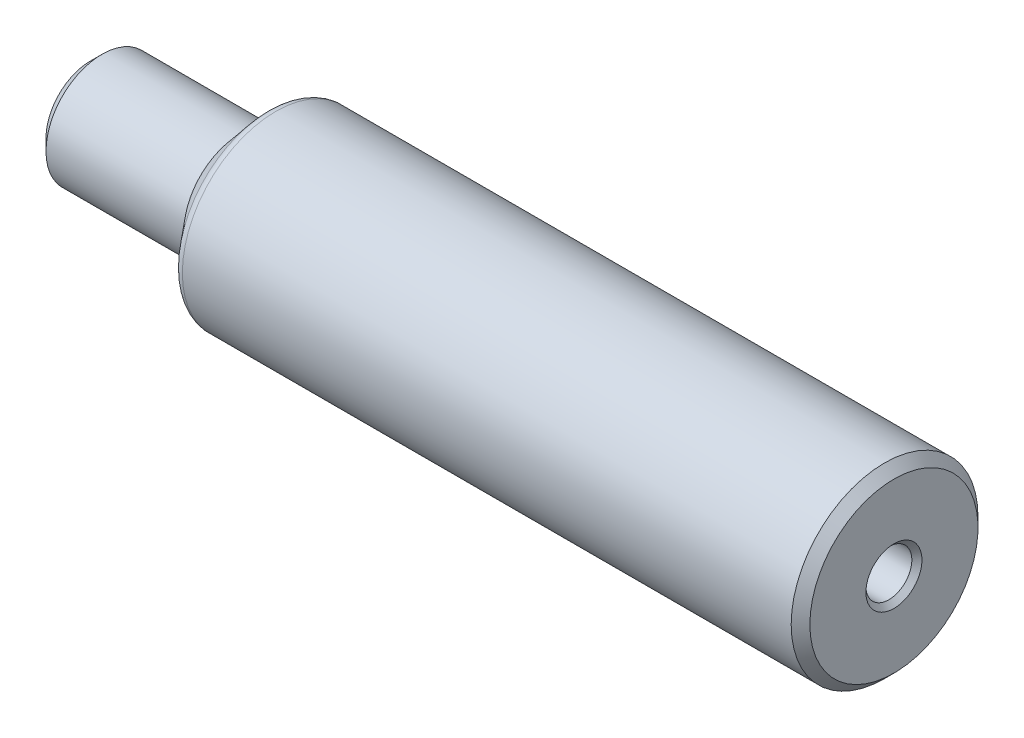
from build123d import *

# Parameters (mm, degrees)
FILLET1_R = 0.5


with BuildPart() as part:
    # Sketch1 → Revolve1 (revolve)
    with BuildSketch(Plane.XY, mode=Mode.PRIVATE) as revolve1_sk:
        Polygon((0, 0), (0, 4.5), (0.5, 5), (34.5, 5), (35, 4.5), (35, 0), align=None)
    revolve(revolve1_sk.sketch.rotate(Axis((35, 0, 0), (-1, 0, 0)), 270), axis=Axis((35, 0, 0), (-1, 0, 0)))

    # Sketch2 → Revolve2 (revolve)
    with BuildSketch(Plane.XY, mode=Mode.PRIVATE) as revolve2_sk:
        Polygon((-8, 0), (-8, 2.3865), (-7.3865, 3), (0, 3), (0, 0), align=None)
    revolve(revolve2_sk.sketch.rotate(Axis((0, 0, 0), (-1, 0, 0)), 270), axis=Axis((0, 0, 0), (-1, 0, 0)))

    # Sketch3 → Cut-Revolve1 (revolve, cut)
    with BuildSketch(Plane.XY, mode=Mode.PRIVATE) as cut_revolve1_sk:
        Polygon((20.5, 0), (21.209852156, 1.2295), (34.7295, 1.2295), (35, 1.5), (35, 0), align=None)
    revolve(cut_revolve1_sk.sketch.rotate(Axis((35, 0, 0), (-1, 0, 0)), 270), axis=Axis((35, 0, 0), (-1, 0, 0)), mode=Mode.SUBTRACT)

    # Sketch5 → Cut-Revolve2 (revolve, cut)
    with BuildSketch(Plane(origin=(0, 0, 0), x_dir=(1, 0, 0), z_dir=(0, 1, 0)), mode=Mode.PRIVATE) as cut_revolve2_sk:
        Polygon((0, 3), (1.678199262, 5), (0, 5), align=None)
    revolve(cut_revolve2_sk.sketch.rotate(Axis((0, 0, 0), (1, 0, 0)), 180), axis=Axis((0, 0, 0), (1, 0, 0)), mode=Mode.SUBTRACT)

    # Fillet1
    fillet1_edges = [part.edges().sort_by_distance(p)[0] for p in [
        (1.678199262, 0, -5),
    ]]
    fillet(fillet1_edges, radius=FILLET1_R)


solid = part.part
